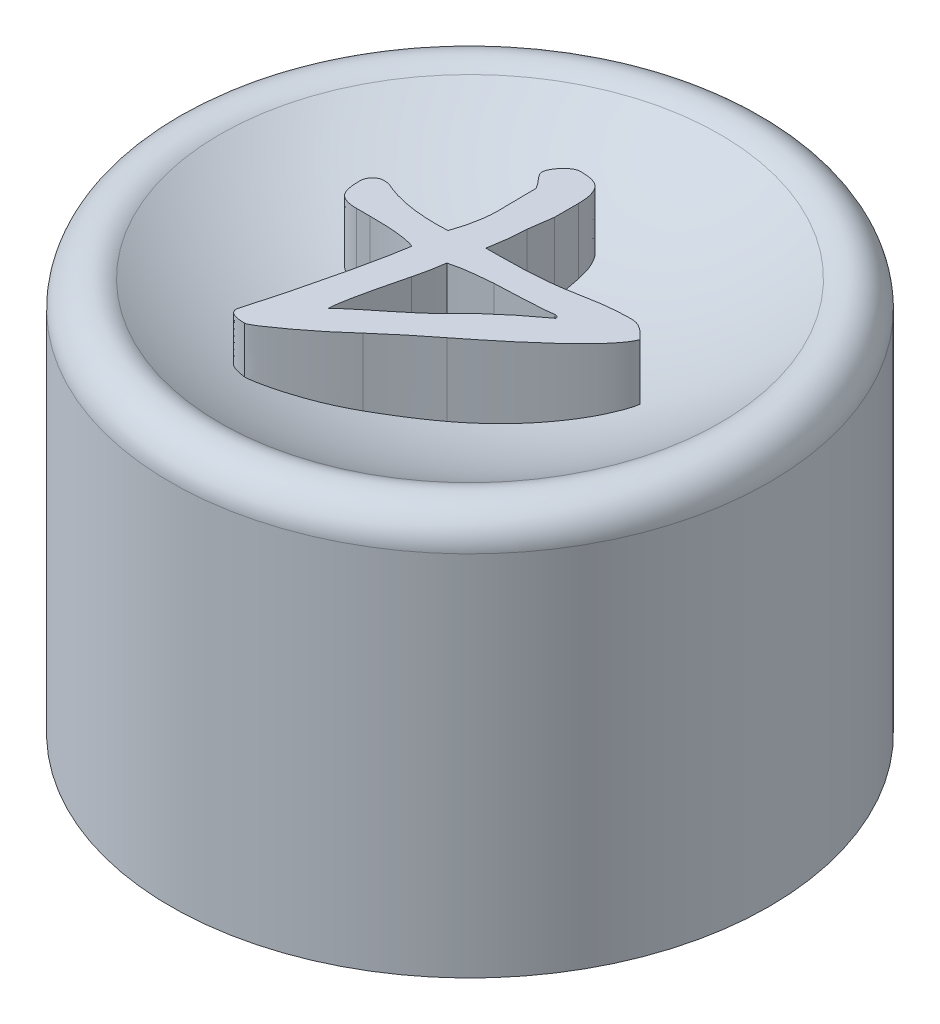
from build123d import *

# Parameters (mm, degrees)
BOSS_EXTRUDE1_REACH      = 11.257
BOSS_EXTRUDE1_END_RADIUS = 7.2532875


with BuildPart() as part:
    # Sketch1 → Revolve1 (revolve)
    with BuildSketch(Plane.XY):
        with BuildLine():
            Line((-1.5494, 0), (-1.5494, 3.048))
            Line((-1.5494, 3.048), (-0.762, 3.048))
            Line((-0.762, 3.048), (-0.762, 4.064))
            Line((-0.762, 4.064), (0, 4.064))
            Line((0, 4.064), (0, 5.08))
            ThreePointArc((0, 5.08), (-2.074697908, 5.383049508), (-3.976029965, 6.266874616))
            ThreePointArc((-3.976029965, 6.266874616), (-4.495955195, 6.288948978), (-4.7625, 5.842))
            Line((-4.7625, 5.842), (-4.7625, 0))
            Line((-4.7625, 0), (-3.4925, 0))
            Line((-3.4925, 0), (-3.4925, 4.064))
            Line((-3.4925, 4.064), (-2.0574, 4.064))
            Line((-2.0574, 4.064), (-2.0574, 0))
            Line((-2.0574, 0), (-1.5494, 0))
        make_face()
    revolve(axis=Axis((0, 0, 0), (0, -1, 0)))

    # Boss-Extrude1: up to this sphere (the profile starts inside it)
    boss_extrude1_end = Location((0, 12.3332875, 0)) * Sphere(BOSS_EXTRUDE1_END_RADIUS, mode=Mode.PRIVATE)
    # Sketch3 → Boss-Extrude1 (add, up to the surface)
    with BuildSketch(Plane(origin=(0, 6.35, 0), x_dir=(-1, 0, 0), z_dir=(0, 1, 0)), mode=Mode.PRIVATE) as boss_extrude1_sk1:
        with BuildLine():
            add(Edge.make_bspline(
                [(1.804776503, -0.548428501), (1.767598192, -0.534072315), (1.692219736, -0.50496537), (1.574267703, -0.470892305), (1.451168549, -0.441854292), (1.32224248, -0.422273573), (1.187845257, -0.406234374), (1.04784434, -0.399892155), (0.902329986, -0.396977504), (0.803787888, -0.401834483), (0.753560127, -0.404310127)],
                knots=[0, 0, 0, 0, 0.893757501, 1.812079599, 2.75192675, 3.729380986, 4.736023103, 5.787158297, 6.872095422, 8, 8, 8, 8], degree=3))
            add(Edge.make_bspline(
                [(0.753560127, -0.404310127), (0.734014617, -0.463051805), (0.695941075, -0.577477256), (0.657220944, -0.7497259), (0.630493411, -0.915892803), (0.627742029, -1.025270681), (0.626396855, -1.07874644)],
                knots=[0, 0, 0, 0, 1.076839182, 2.097621536, 3.06991126, 4, 4, 4, 4], degree=3))
            Line((0.626396855, -1.07874644), (0.630164656, -1.221922864))
            Line((0.630164656, -1.221922864), (0.630164656, -1.350970036))
            Line((0.630164656, -1.350970036), (0.632990506, -1.49414646))
            add(Edge.make_bspline(
                [(0.632990506, -1.49414646), (0.633865357, -1.512984495), (0.635468845, -1.547512178), (0.634270617, -1.594291002), (0.636214397, -1.631109551), (0.631441794, -1.660632517), (0.637159767, -1.690307496), (0.657022856, -1.7224408), (0.684372598, -1.763934139), (0.709464627, -1.792134369), (0.723417722, -1.807815862)],
                knots=[0, 0, 0, 0, 1.323059696, 2.424997425, 3.284508854, 3.903166176, 4.50832967, 5.356177487, 6.5298317, 8, 8, 8, 8], degree=3))
            add(Edge.make_bspline(
                [(0.723417722, -1.807815862), (0.736899218, -1.822990429), (0.760993383, -1.850110454), (0.789202144, -1.88874496), (0.808680753, -1.919556922), (0.812353294, -1.939232878), (0.813844937, -1.947224486)],
                knots=[0, 0, 0, 0, 1.445068314, 2.582629794, 3.424319386, 4, 4, 4, 4], degree=3))
            add(Edge.make_bspline(
                [(0.813844937, -1.947224486), (0.81248612, -1.963746516), (0.809626811, -1.998513215), (0.787093329, -2.050284934), (0.755332447, -2.105519893), (0.710263796, -2.158350739), (0.66204781, -2.207753404), (0.610968192, -2.243762318), (0.56061964, -2.268236363), (0.526157505, -2.271547778), (0.509595036, -2.273139241)],
                knots=[0, 0, 0, 0, 0.829105942, 1.744657049, 2.807027883, 4.031133061, 5.22675718, 6.27015558, 7.168638393, 8, 8, 8, 8], degree=3))
            add(Edge.make_bspline(
                [(0.509595036, -2.273139241), (0.470880909, -2.271781736), (0.40000714, -2.269296559), (0.30319293, -2.24978677), (0.226398542, -2.214279263), (0.169386806, -2.161299736), (0.134778716, -2.092175066), (0.107540757, -2.012811721), (0.093841406, -1.91878017), (0.091610141, -1.851802331), (0.090427215, -1.816293414)],
                knots=[0, 0, 0, 0, 1.28173678, 2.346469459, 3.248698668, 4.050474585, 4.869595417, 5.780472292, 6.823296977, 8, 8, 8, 8], degree=3))
            add(Edge.make_bspline(
                [(0.090427215, -1.816293414), (0.090427215, -1.793058643), (0.090427215, -1.740623418), (0.090427215, -1.653022053), (0.090427215, -1.547837619), (0.090427215, -1.471853639), (0.090427215, -1.431035799)],
                knots=[0, 0, 0, 0, 0.723716381, 1.633251834, 2.728606357, 4, 4, 4, 4], degree=3))
            add(Edge.make_bspline(
                [(0.090427215, -1.431035799), (0.096854515, -1.391181528), (0.108838863, -1.31686922), (0.123374706, -1.213133466), (0.136624317, -1.1257272), (0.141797365, -1.072490104), (0.144118374, -1.048604035)],
                knots=[0, 0, 0, 0, 1.254151062, 2.338491141, 3.254525171, 4, 4, 4, 4], degree=3))
            add(Edge.make_bspline(
                [(0.144118374, -1.048604035), (0.149708831, -0.948848135), (0.160726076, -0.752256821), (0.194406698, -0.558265678), (0.210996835, -0.462711036)],
                knots=[0, 0, 0, 0, 1.01485562, 2, 2, 2, 2], degree=3))
            add(Edge.make_bspline(
                [(0.210996835, -0.462711036), (0.196868546, -0.463116604), (0.165476611, -0.464017742), (0.113656227, -0.46326651), (0.052754911, -0.465007239), (0.00910666, -0.464738173), (-0.014129252, -0.464594937)],
                knots=[0, 0, 0, 0, 0.753264755, 1.673694439, 2.761603698, 4, 4, 4, 4], degree=3))
            add(Edge.make_bspline(
                [(-0.014129252, -0.464594937), (-0.069081631, -0.464580643), (-0.176183056, -0.464552783), (-0.33285831, -0.469987578), (-0.481737279, -0.476118025), (-0.622777391, -0.485380628), (-0.755560202, -0.497960077), (-0.880426939, -0.511368006), (-0.99716818, -0.529586585), (-1.072284373, -0.543548419), (-1.108675336, -0.550312401)],
                knots=[0, 0, 0, 0, 1.199320842, 2.337459686, 3.421319547, 4.451573908, 5.421966406, 6.332404232, 7.19211272, 8, 8, 8, 8], degree=3))
            add(Edge.make_bspline(
                [(-1.108675336, -0.550312401), (-1.182978033, -0.564773025), (-1.327028897, -0.59280788), (-1.538827258, -0.623064701), (-1.739428074, -0.642087317), (-1.869732475, -0.64435189), (-1.932881725, -0.645449367)],
                knots=[0, 0, 0, 0, 1.092875108, 2.118760302, 3.08829729, 4, 4, 4, 4], degree=3))
            add(Edge.make_bspline(
                [(-1.932881725, -0.645449367), (-1.959357303, -0.642556602), (-2.016923032, -0.636266876), (-2.101815665, -0.590919535), (-2.18987113, -0.52127441), (-2.245467451, -0.462019693), (-2.275751582, -0.429742781)],
                knots=[0, 0, 0, 0, 0.762871101, 1.658707116, 2.724663474, 4, 4, 4, 4], degree=3))
            add(Edge.make_bspline(
                [(-2.275751582, -0.429742781), (-2.268610251, -0.412281501), (-2.253099513, -0.374356172), (-2.218724182, -0.316975315), (-2.175764878, -0.253378072), (-2.122354611, -0.184644255), (-2.060055412, -0.109992481), (-1.987330671, -0.029988708), (-1.903967032, 0.055322245), (-1.812216386, 0.147930607), (-1.708998925, 0.244762564), (-1.596035611, 0.34718903), (-1.473517737, 0.455459752), (-1.3415128, 0.569666452), (-1.199219113, 0.689250219), (-1.046630982, 0.814169178), (-0.884583987, 0.945464012), (-0.772501996, 1.033862604), (-0.71494017, 1.079261373)],
                knots=[0, 0, 0, 0, 0.413943338, 0.899071395, 1.465387986, 2.100050456, 2.810152568, 3.601301516, 4.47453093, 5.430558485, 6.465043167, 7.583322452, 8.780594558, 10.05704088, 11.418082916, 12.863938001, 14.38941607, 16, 16, 16, 16], degree=3))
            add(Edge.make_bspline(
                [(-0.71494017, 1.079261373), (-0.642897844, 1.135916385), (-0.505404305, 1.244043074), (-0.310724573, 1.401619405), (-0.137677217, 1.546662853), (-0.031196327, 1.641373008), (0.018839003, 1.685877275)],
                knots=[0, 0, 0, 0, 1.154951779, 2.204237657, 3.156171946, 4, 4, 4, 4], degree=3))
            add(Edge.make_bspline(
                [(0.018839003, 1.685877275), (0.068792249, 1.731100578), (0.170457668, 1.823139563), (0.330499242, 1.95704582), (0.498663656, 2.090961411), (0.642083892, 2.20064327), (0.756027406, 2.282503689), (0.831565817, 2.337602564), (0.899077989, 2.382561203), (0.956256846, 2.42082163), (1.004815528, 2.449964216), (1.044089872, 2.470672771), (1.073390608, 2.48597366), (1.091316993, 2.488409875), (1.098313884, 2.489360759)],
                knots=[0, 0, 0, 0, 1.795375167, 3.653968139, 5.559038922, 7.523533907, 8.464051893, 9.297561039, 10.014597124, 10.624894836, 11.131397929, 11.52068866, 11.812918814, 12, 12, 12, 12], degree=3))
            add(Edge.make_bspline(
                [(1.098313884, 2.489360759), (1.118429532, 2.489134626), (1.156274694, 2.488709184), (1.208976025, 2.482136557), (1.253869617, 2.471926299), (1.290948313, 2.458641169), (1.319976532, 2.439913394), (1.341342565, 2.417271892), (1.354791356, 2.389210857), (1.355856145, 2.368939947), (1.356408228, 2.358429688)],
                knots=[0, 0, 0, 0, 1.498411303, 2.819079836, 3.948660039, 4.926485253, 5.737803691, 6.49969329, 7.222106306, 8, 8, 8, 8], degree=3))
            add(Edge.make_bspline(
                [(1.356408228, 2.358429688), (1.353962513, 2.348051198), (1.347934983, 2.322473129), (1.33489511, 2.27691951), (1.319729547, 2.216011988), (1.298109174, 2.140353413), (1.274462404, 2.049298193), (1.244580244, 1.943757329), (1.212041903, 1.822983443), (1.188188615, 1.737663786), (1.175553797, 1.692470926)],
                knots=[0, 0, 0, 0, 0.370784294, 0.913807931, 1.647455451, 2.553453175, 3.65004405, 4.919021692, 6.368040501, 8, 8, 8, 8], degree=3))
            add(Edge.make_bspline(
                [(1.175553797, 1.692470926), (1.153409671, 1.604596121), (1.110739818, 1.435268831), (1.051730164, 1.1898876), (0.997236867, 0.963199557), (0.951636151, 0.754118081), (0.91113832, 0.563844059), (0.875423987, 0.392366402), (0.84840209, 0.23893345), (0.83318902, 0.142668506), (0.826090289, 0.097749308)],
                knots=[0, 0, 0, 0, 1.331737132, 2.566144437, 3.70884513, 4.757851846, 5.71080335, 6.567765208, 7.331689862, 8, 8, 8, 8], degree=3))
            add(Edge.make_bspline(
                [(0.826090289, 0.097749308), (0.844823741, 0.091112967), (0.885181959, 0.076816034), (0.952902587, 0.06170921), (1.030466453, 0.047562796), (1.118830955, 0.036377148), (1.217542319, 0.028427865), (1.326813545, 0.021630396), (1.446496312, 0.017983625), (1.529724858, 0.017786286), (1.573056764, 0.017683544)],
                knots=[0, 0, 0, 0, 0.631641855, 1.360771086, 2.203131279, 3.139634858, 4.192129127, 5.35274418, 6.621739235, 8, 8, 8, 8], degree=3))
            Line((1.573056764, 0.017683544), (1.791589201, 0.017683544))
            add(Edge.make_bspline(
                [(1.791589201, 0.017683544), (1.819930953, 0.017041386), (1.872692706, 0.015845926), (1.945952906, 0.000541587), (2.007307238, -0.0235785), (2.059629357, -0.058523154), (2.098025172, -0.113047374), (2.123732442, -0.186943955), (2.136946492, -0.281705693), (2.138992286, -0.351838168), (2.140110759, -0.390180874)],
                knots=[0, 0, 0, 0, 1.078555881, 2.007868068, 2.834441009, 3.581398985, 4.368761825, 5.326674902, 6.538444277, 8, 8, 8, 8], degree=3))
            add(Edge.make_bspline(
                [(2.140110759, -0.390180874), (2.139324456, -0.40249661), (2.137763965, -0.426938318), (2.127015381, -0.462633219), (2.108652402, -0.496230611), (2.083382983, -0.526106091), (2.055310591, -0.552761561), (2.022854864, -0.571015548), (1.988973264, -0.582966773), (1.965317407, -0.584436732), (1.953604628, -0.585164557)],
                knots=[0, 0, 0, 0, 0.994779331, 1.974230872, 2.984742723, 4.066641822, 5.126597084, 6.092812184, 7.055689745, 8, 8, 8, 8], degree=3))
            add(Edge.make_bspline(
                [(1.953604628, -0.585164557), (1.926131034, -0.583874575), (1.874026601, -0.58142809), (1.827004717, -0.55902086), (1.804776503, -0.548428501)],
                knots=[0, 0, 0, 0, 1.054558785, 2, 2, 2, 2], degree=3))
        make_face()
        with BuildLine():
            add(Edge.make_bspline(
                [(0.633932456, 1.618056863), (0.622692436, 1.607001355), (0.597508122, 1.582230457), (0.5539045, 1.542569269), (0.500237995, 1.497099846), (0.438103566, 1.443934002), (0.366032872, 1.38485513), (0.285644, 1.317453286), (0.193694038, 1.245792013), (0.13022477, 1.194590647), (0.097020866, 1.167804688)],
                knots=[0, 0, 0, 0, 0.539758589, 1.209379492, 2.017427871, 2.947918542, 4.009135206, 5.208002069, 6.539368204, 8, 8, 8, 8], degree=3))
            add(Edge.make_bspline(
                [(0.097020866, 1.167804688), (0.069022675, 1.145264191), (0.01497068, 1.101748565), (-0.062327379, 1.037747455), (-0.133017893, 0.977140931), (-0.198097243, 0.92106229), (-0.25609418, 0.868172248), (-0.308723815, 0.820343691), (-0.353440752, 0.774900016), (-0.381499754, 0.746133396), (-0.394677116, 0.732623714)],
                knots=[0, 0, 0, 0, 1.31284575, 2.534518407, 3.665226919, 4.713861806, 5.671988414, 6.532179731, 7.310666839, 8, 8, 8, 8], degree=3))
            add(Edge.make_bspline(
                [(-0.394677116, 0.732623714), (-0.423715586, 0.70232125), (-0.483480262, 0.63995512), (-0.578699624, 0.547032112), (-0.681052397, 0.451403772), (-0.793264075, 0.356267325), (-0.910121627, 0.255528902), (-1.036920335, 0.155029016), (-1.171593097, 0.0528053), (-1.264039861, -0.015988724), (-1.31119462, -0.051078817)],
                knots=[0, 0, 0, 0, 0.834045236, 1.716565745, 2.643838071, 3.617125915, 4.6398281, 5.709864835, 6.831859903, 8, 8, 8, 8], degree=3))
            add(Edge.make_bspline(
                [(-1.31119462, -0.051078817), (-1.310564347, -0.058164836), (-1.309386787, -0.07140387), (-1.297684849, -0.08861886), (-1.278007737, -0.098240107), (-1.262949645, -0.098806908), (-1.254677611, -0.099118275)],
                knots=[0, 0, 0, 0, 1.000247552, 1.868794244, 2.829240256, 4, 4, 4, 4], degree=3))
            add(Edge.make_bspline(
                [(-1.254677611, -0.099118275), (-1.241190271, -0.096830089), (-1.207120849, -0.091050061), (-1.145240887, -0.083748746), (-1.061895146, -0.078033576), (-0.957738265, -0.069756541), (-0.832353811, -0.06422147), (-0.686425553, -0.055804067), (-0.519317189, -0.050068597), (-0.400953202, -0.04518961), (-0.338160107, -0.042601266)],
                knots=[0, 0, 0, 0, 0.357353646, 0.902685978, 1.626792487, 2.539639752, 3.632091938, 4.905183088, 6.358173479, 8, 8, 8, 8], degree=3))
            add(Edge.make_bspline(
                [(-0.338160107, -0.042601266), (-0.302047307, -0.039849771), (-0.232290355, -0.034534872), (-0.131699767, -0.025663788), (-0.038905033, -0.013619579), (0.046620852, -0.002855526), (0.124831415, 0.009412979), (0.195242084, 0.022369671), (0.258117996, 0.036441579), (0.297068603, 0.047356046), (0.315553303, 0.0525357)],
                knots=[0, 0, 0, 0, 1.313689343, 2.537575741, 3.661990862, 4.707321964, 5.664096799, 6.532992637, 7.303805695, 8, 8, 8, 8], degree=3))
            add(Edge.make_bspline(
                [(0.315553303, 0.0525357), (0.320269874, 0.088377792), (0.330065632, 0.162817575), (0.351370815, 0.277026763), (0.3764725, 0.39810476), (0.397191606, 0.480252789), (0.407864419, 0.522568829)],
                knots=[0, 0, 0, 0, 0.904874322, 1.879316844, 2.907595037, 4, 4, 4, 4], degree=3))
            add(Edge.make_bspline(
                [(0.407864419, 0.522568829), (0.425513386, 0.592570014), (0.459042965, 0.725558543), (0.505654917, 0.914718741), (0.54381333, 1.083201928), (0.576732852, 1.230536099), (0.600853528, 1.357248157), (0.61928114, 1.462628426), (0.63065893, 1.547173633), (0.632945416, 1.596684003), (0.633932456, 1.618056863)],
                knots=[0, 0, 0, 0, 1.547027948, 2.939049863, 4.17462939, 5.248905693, 6.173937003, 6.938288368, 7.541675544, 8, 8, 8, 8], degree=3))
        make_face(mode=Mode.SUBTRACT)
    boss_extrude1_tool1 = extrude(boss_extrude1_sk1.sketch, amount=-BOSS_EXTRUDE1_REACH, mode=Mode.PRIVATE) & boss_extrude1_end
    add(boss_extrude1_tool1.solids().sort_by_distance((-1.295659, 6.35, -0.354012))[0])


solid = part.part
